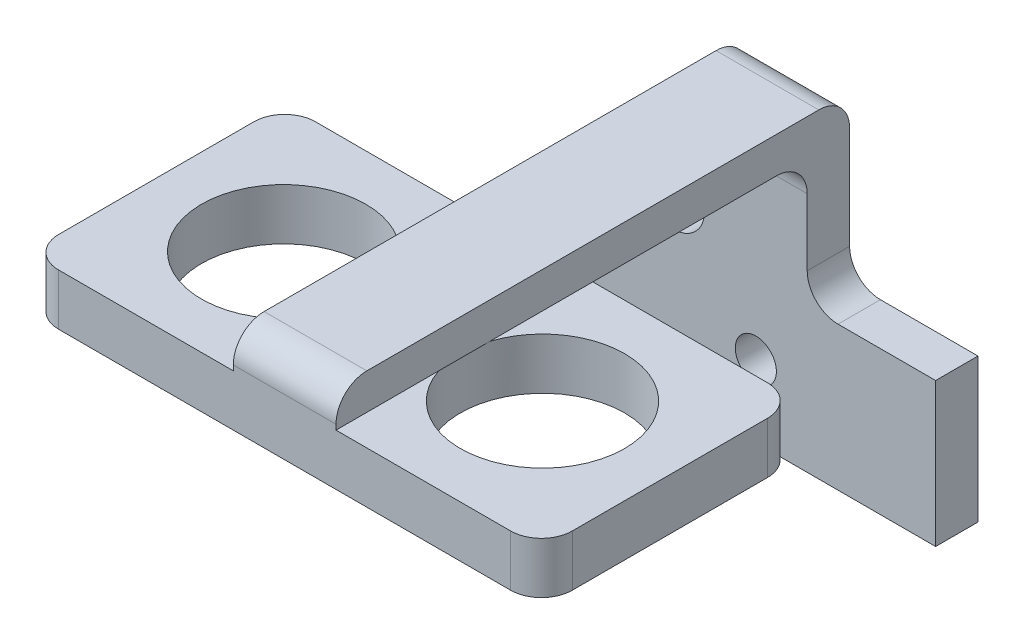
from build123d import *

# Parameters (mm, degrees)
SKETCH1_W                      = 50
SKETCH1_H                      = 25
BOSS_EXTRUDE1_DEPTH            = 5
SKETCH2_W                      = 10
SKETCH2_H                      = 50
BOSS_EXTRUDE2_DEPTH            = 3.5
SKETCH3_W                      = 10
SKETCH3_H                      = 4.126638733
BOSS_EXTRUDE3_DEPTH            = 26.5
SKETCH4_W                      = 4.126638733
SKETCH4_H                      = 14
BOSS_EXTRUDE4_DEPTH            = 12.5
SKETCH5_W                      = 4.126638733
SKETCH5_H                      = 14
BOSS_EXTRUDE5_DEPTH            = 12.5
F_4_0_4_DIAMETER_HOLE1_D       = 4
F_4_0_4_DIAMETER_HOLE1_DEPTH   = 50
F_16_0_16_DIAMETER_HOLE1_D     = 16
F_16_0_16_DIAMETER_HOLE1_DEPTH = 5
FILLET1_R                      = 3


with BuildPart() as part:
    # Sketch1 → Boss-Extrude1 (new body)
    with BuildSketch(Plane.XZ.offset(5)):
        Rectangle(SKETCH1_W, SKETCH1_H)
    extrude(amount=-BOSS_EXTRUDE1_DEPTH)

    # Sketch2 → Boss-Extrude2 (add)
    with BuildSketch(Plane(origin=(0, 0, 0), x_dir=(-1, 0, 0), z_dir=(0, 1, 0))):
        with Locations((0, -12.5)):
            Rectangle(SKETCH2_W, SKETCH2_H)
    extrude(amount=BOSS_EXTRUDE2_DEPTH)

    # Sketch3 → Boss-Extrude3 (add)
    with BuildSketch(Plane.XZ):
        with Locations((0, -35.436680634)):
            Rectangle(SKETCH3_W, SKETCH3_H)
    extrude(amount=BOSS_EXTRUDE3_DEPTH)

    # Sketch4 → Boss-Extrude4 (add)
    with BuildSketch(Plane(origin=(5, 0, 0), x_dir=(0, 0, -1), z_dir=(1, 0, 0))):
        with Locations((35.436680634, -19.5)):
            Rectangle(SKETCH4_W, SKETCH4_H)
    extrude(amount=BOSS_EXTRUDE4_DEPTH)

    # Sketch5 → Boss-Extrude5 (add)
    with BuildSketch(Plane.ZY.offset(5)):
        with Locations((-35.436680634, -19.5)):
            Rectangle(SKETCH5_W, SKETCH5_H)
    extrude(amount=BOSS_EXTRUDE5_DEPTH)

    # Ø4.0 (4) Diameter Hole1
    with Locations(Plane(origin=(0, 0, -37.5), x_dir=(-1, 0, 0), z_dir=(0, 0, -1))):
        with Locations((0, -19.5)):
            Hole(F_4_0_4_DIAMETER_HOLE1_D / 2, depth=F_4_0_4_DIAMETER_HOLE1_DEPTH)

    # Ø16.0 (16) Diameter Hole1
    with Locations(Plane.XZ.offset(5)):
        with Locations((-12.6, 0)):
            f_16_0_16_diameter_hole1 = Hole(F_16_0_16_DIAMETER_HOLE1_D / 2, depth=F_16_0_16_DIAMETER_HOLE1_DEPTH)

    # Fillet1
    fillet1_edges = [part.edges().sort_by_distance(p)[0] for p in [
        (0, 3.5, 12.5),
        (0, 3.5, -37.5),
        (0, 0, -33.373361267),
        (5, -12.5, -35.436680634),
        (-5, -12.5, -35.436680634),
        (25, -2.5, 12.5),
        (25, -2.5, -12.5),
        (-25, -2.5, -12.5),
        (-25, -2.5, 12.5),
    ]]
    fillet(fillet1_edges, radius=FILLET1_R)

    # Mirror1: Ø16.0 (16) Diameter Hole1 across plane
    add(f_16_0_16_diameter_hole1.mirror(Plane(origin=(0, 0, 0), x_dir=(0, 0, 1), z_dir=(1, 0, 0))), mode=Mode.SUBTRACT)


solid = part.part
